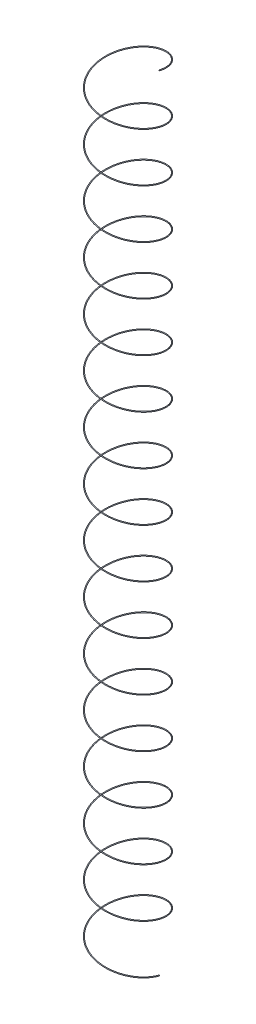
from build123d import *

# Parameters (mm, degrees)
SWEEP1_PITCH       = 31.3
SWEEP1_HEIGHT      = 500.8
SWEEP1_RADIUS      = 19.9
SWEEP1_START_ANGLE = 90
SKETCH2_R          = 0.25


with BuildPart() as part:
    # Sweep1: sweep along a helix
    with BuildLine() as sweep1_path:
        add(Helix(SWEEP1_PITCH, SWEEP1_HEIGHT, SWEEP1_RADIUS, center=(0, 0, 0), direction=(0, 1, 0), lefthand=True, mode=Mode.PRIVATE).rotate(Axis((0, 0, 0), (0, 1, 0)), SWEEP1_START_ANGLE))
    # Sketch2 → Sweep1 (sweep)
    with BuildSketch(Plane.XY):
        with Locations((19.9, 0)):
            Circle(SKETCH2_R)
    sweep(path=sweep1_path.line, is_frenet=True)


solid = part.part
